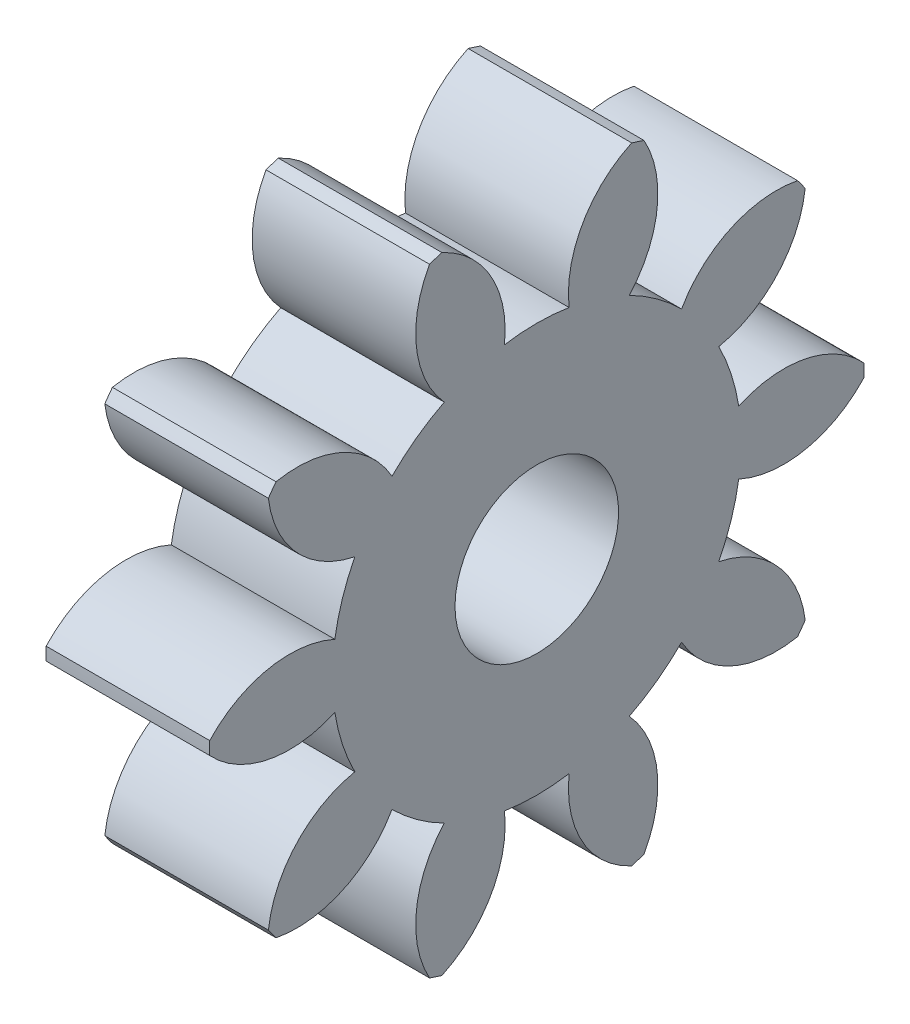
from build123d import *

# Parameters (mm, degrees)
BASPROSKE_W     = 3
BASPROSKE_H     = 6
TOOTHCUT_DEPTH  = 10
TEETHCUTS_COUNT = 10
TEETHCUTS_ANGLE = 324
BORSKE_R        = 1.5
BORE_DEPTH      = 50.0000508


with BuildPart() as part:
    # BasProSke → Base-Revolve (revolve)
    with BuildSketch(Plane(origin=(0, 0, 0), x_dir=(1, 0, 0), z_dir=(0, 1, 0)), mode=Mode.PRIVATE) as base_revolve_sk:
        with Locations((1.5, 3)):
            Rectangle(BASPROSKE_W, BASPROSKE_H)
    revolve(base_revolve_sk.sketch.rotate(Axis((-10, 0, 0), (1, 0, 0)), 180), axis=Axis((-10, 0, 0), (1, 0, 0)))

    # TooCutSke → ToothCut (cut, through all)
    with BuildSketch(Plane(origin=(0, 0, 0), x_dir=(0, 0, -1), z_dir=(1, 0, 0))):
        with BuildLine():
            ThreePointArc((0.59278292, 3.701838653), (0, 3.749), (-0.59278292, 3.701838653))
            ThreePointArc((-0.59278292, 3.701838653), (-0.846593509, 4.924114224), (-1.775771316, 5.757784417))
            ThreePointArc((-1.775771316, 5.757784417), (0, 6.0254), (1.775771316, 5.757784417))
            ThreePointArc((1.775771316, 5.757784417), (0.846593509, 4.924114224), (0.59278292, 3.701838653))
        make_face()
    toothcut = extrude(amount=TOOTHCUT_DEPTH, mode=Mode.SUBTRACT)

    # TeethCuts: ToothCut ×10 about axis
    teethcuts_axis = Axis((-10, 0, 0), (1, 0, 0))
    for i in range(1, TEETHCUTS_COUNT):
        add(toothcut.rotate(teethcuts_axis, i * TEETHCUTS_ANGLE / (TEETHCUTS_COUNT - 1)), mode=Mode.SUBTRACT)

    # BorSke → Bore (cut, symmetric)
    with BuildSketch(Plane(origin=(0, 0, 0), x_dir=(0, 0, -1), z_dir=(1, 0, 0))):
        with Locations(Location((0, 0, 0), (0, 0, 180))):
            Circle(BORSKE_R)
    extrude(amount=BORE_DEPTH, both=True, mode=Mode.SUBTRACT)


solid = part.part
